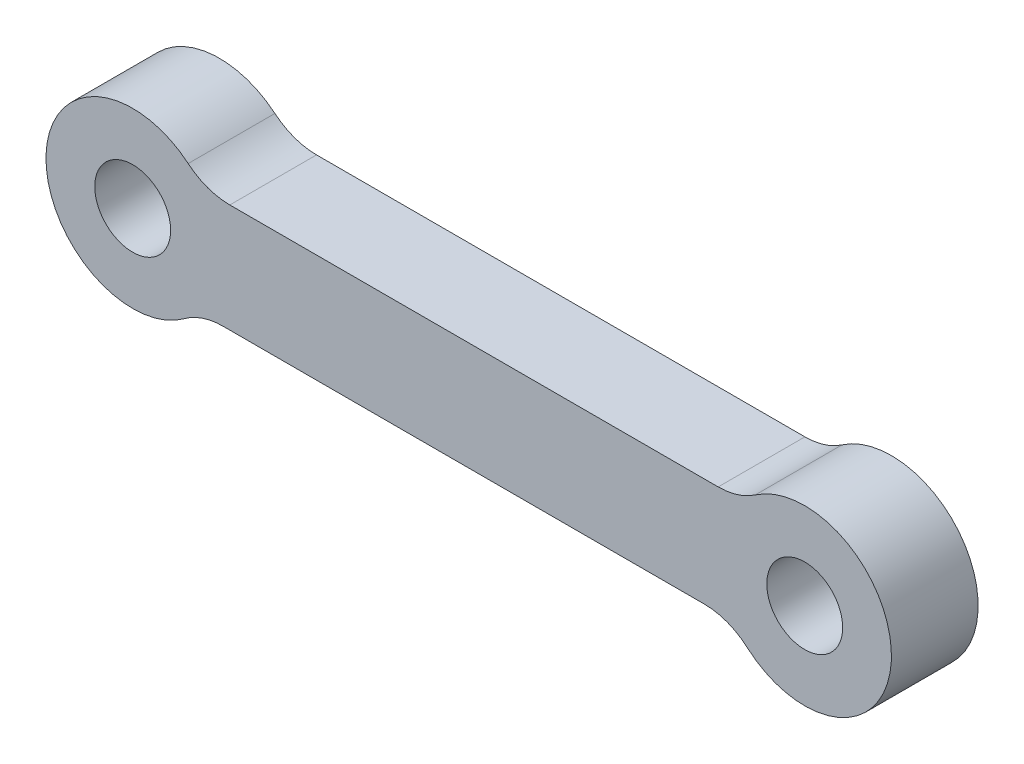
from build123d import *

# Parameters (mm, degrees)
SKETCH_1_R      = 1.75
EXTRUDE_1_DEPTH = 4


with BuildPart() as part:
    # 草图1 → 凸台-拉伸1 (new body)
    with BuildSketch(Plane.XY):
        with BuildLine():
            Line((-10.652871244, 2.5), (11.87376934, 2.5))
            ThreePointArc((11.87376934, 2.5), (12.769863951, 2.636957135), (13.584140863, 3.035323702))
            ThreePointArc((13.584140863, 3.035323702), (19.857878254, -0.483329334), (13.218294526, -3.250390584))
            ThreePointArc((13.218294526, -3.250390584), (12.294474571, -2.69386135), (11.23353825, -2.5))
            Line((11.23353825, -2.5), (-10.962064336, -2.5))
            ThreePointArc((-10.962064336, -2.5), (-11.903405007, -2.651513079), (-12.749662064, -3.090748174))
            ThreePointArc((-12.749662064, -3.090748174), (-19.131546465, 0.233977056), (-12.572980297, 3.194966112))
            ThreePointArc((-12.572980297, 3.194966112), (-11.673875244, 2.67908688), (-10.652871244, 2.5))
        make_face()
        with Locations((-15.133125701, 0.121587595)):
            Circle(SKETCH_1_R, mode=Mode.SUBTRACT)
        with Locations((15.864636227, -0.250911362)):
            Circle(SKETCH_1_R, mode=Mode.SUBTRACT)
    extrude(amount=EXTRUDE_1_DEPTH)


solid = part.part
